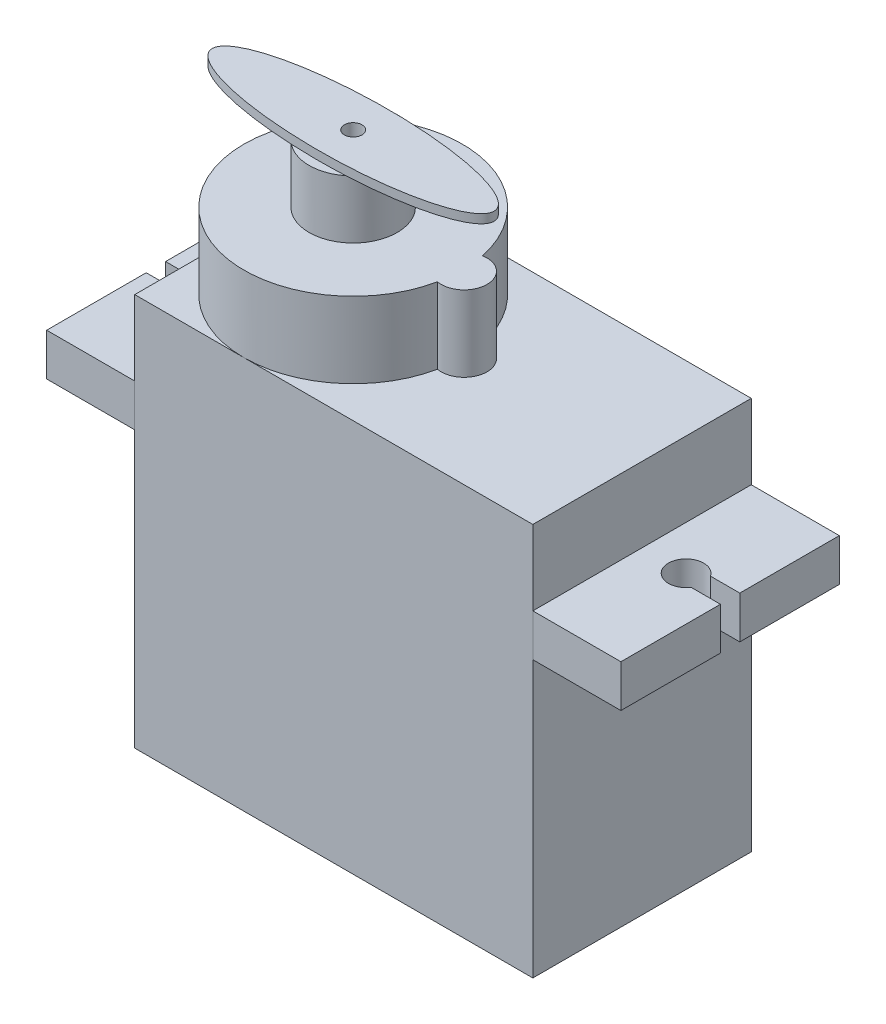
from build123d import *

# Parameters (mm, degrees)
SKETCH1_W             = 22.6
SKETCH1_H             = 12.4
BOSS_EXTRUDE1_DEPTH   = 22.3
SKETCH2_W             = 12.4
SKETCH2_H             = 2.4
BOSS_EXTRUDE2_DEPTH   = 5
SKETCH3_W             = 12.4
SKETCH3_H             = 2.4
BOSS_EXTRUDE3_DEPTH   = 5
CUT_EXTRUDE1_DEPTH    = 2.4
CUT_EXTRUDE2_DEPTH    = 2.4
BOSS_EXTRUDE4_DEPTH   = 4.3
SKETCH7_R             = 2.5
BOSS_EXTRUDE5_DEPTH   = 3.3
SKETCH8_R             = 0.6
BOSS_EXTRUDE7_DEPTH   = 2.3
BOSS_EXTRUDE7_2_DEPTH = 2.3
BOSS_EXTRUDE7_3_DEPTH = 2.3
SKETCH9_RX            = 7.998818951
SKETCH9_RY            = 2
BOSS_EXTRUDE10_DEPTH  = 0.5
SKETCH12_R            = 0.5
CUT_EXTRUDE4_DEPTH    = 1


with BuildPart() as part:
    # Sketch1 → Boss-Extrude1 (new body)
    with BuildSketch(Plane(origin=(0, 0, 0), x_dir=(1, 0, 0), z_dir=(0, 1, 0))):
        Rectangle(SKETCH1_W, SKETCH1_H)
    extrude(amount=BOSS_EXTRUDE1_DEPTH)

    # Sketch6 → Boss-Extrude4 (add)
    with BuildSketch(Plane(origin=(0, 22.3, 0), x_dir=(1, 0, 0), z_dir=(0, 1, 0))):
        with BuildLine():
            ThreePointArc((0.966666667, -1.278888406), (2.5, 0), (0.966666667, 1.278888406))
            ThreePointArc((0.966666667, 1.278888406), (-11.3, 0), (0.966666667, -1.278888406))
        make_face()
    extrude(amount=BOSS_EXTRUDE4_DEPTH)

    # Sketch7 → Boss-Extrude5 (add)
    with BuildSketch(Plane(origin=(0, 26.6, 0), x_dir=(1, 0, 0), z_dir=(0, 1, 0))):
        with Locations(Location((-5.1, 0, 0), (0, 0, 270))):
            Circle(SKETCH7_R)
    extrude(amount=BOSS_EXTRUDE5_DEPTH)

    # Sketch9 → Boss-Extrude10 (add)
    with BuildSketch(Plane(origin=(0, 29.9, 0), x_dir=(1, 0, 0), z_dir=(0, 1, 0))):
        with Locations((-5.1, 0)):
            Ellipse(SKETCH9_RX, SKETCH9_RY)
    extrude(amount=BOSS_EXTRUDE10_DEPTH)

    # Sketch12 → Cut-Extrude4 (cut)
    with BuildSketch(Plane(origin=(0, 30.4, 0), x_dir=(1, 0, 0), z_dir=(0, 1, 0))):
        with Locations(Location((-5.1, 0, 0), (0, 0, 270))):
            Circle(SKETCH12_R)
    extrude(amount=-CUT_EXTRUDE4_DEPTH, mode=Mode.SUBTRACT)


with BuildPart() as body_2:
    # Sketch2 → Boss-Extrude2 (new body)
    with BuildSketch(Plane(origin=(11.3, 0, 0), x_dir=(0, 0, -1), z_dir=(1, 0, 0))):
        with Locations((0, 16.85)):
            Rectangle(SKETCH2_W, SKETCH2_H)
    extrude(amount=BOSS_EXTRUDE2_DEPTH)

    # Sketch5 → Cut-Extrude2 (cut)
    with BuildSketch(Plane(origin=(0, 18.05, 0), x_dir=(1, 0, 0), z_dir=(0, 1, 0))):
        with BuildLine():
            Line((14.635164654, 0.55), (16.3, 0.55))
            Line((16.3, 0.55), (16.3, -0.55))
            Line((16.3, -0.55), (14.635164654, -0.55))
            ThreePointArc((14.635164654, -0.55), (12.8, 0), (14.635164654, 0.55))
        make_face()
    extrude(amount=-CUT_EXTRUDE2_DEPTH, mode=Mode.SUBTRACT)


with BuildPart() as body_3:
    # Sketch3 → Boss-Extrude3 (new body)
    with BuildSketch(Plane.ZY.offset(11.3)):
        with Locations((0, 16.85)):
            Rectangle(SKETCH3_W, SKETCH3_H)
    extrude(amount=BOSS_EXTRUDE3_DEPTH)

    # Sketch4 → Cut-Extrude1 (cut)
    with BuildSketch(Plane(origin=(0, 18.05, 0), x_dir=(1, 0, 0), z_dir=(0, 1, 0))):
        with BuildLine():
            Line((-16.3, 0.55), (-14.635164654, 0.55))
            ThreePointArc((-14.635164654, 0.55), (-12.8, 0), (-14.635164654, -0.55))
            Line((-14.635164654, -0.55), (-16.3, -0.55))
            Line((-16.3, -0.55), (-16.3, 0.55))
        make_face()
        with BuildLine():
            Line((16.3, -0.55), (14.635164654, -0.55))
            ThreePointArc((14.635164654, -0.55), (12.8, 0), (14.635164654, 0.55))
            Line((14.635164654, 0.55), (16.3, 0.55))
            Line((16.3, 0.55), (16.3, -0.55))
        make_face()
    extrude(amount=-CUT_EXTRUDE1_DEPTH, mode=Mode.SUBTRACT)


with BuildPart() as body_4:
    # Sketch8 → Boss-Extrude7 (new body)
    with BuildSketch(Plane.ZY.offset(11.3)):
        with Locations((0, 4.5)):
            Circle(SKETCH8_R)
    extrude(amount=BOSS_EXTRUDE7_DEPTH)


with BuildPart() as body_5:
    # Sketch8 → Boss-Extrude7 2 (new body)
    with BuildSketch(Plane.ZY.offset(11.3)):
        with Locations((-1.2, 4.5)):
            Circle(SKETCH8_R)
    extrude(amount=BOSS_EXTRUDE7_2_DEPTH)


with BuildPart() as body_6:
    # Sketch8 → Boss-Extrude7 3 (new body)
    with BuildSketch(Plane.ZY.offset(11.3)):
        with Locations((1.2, 4.5)):
            Circle(SKETCH8_R)
    extrude(amount=BOSS_EXTRUDE7_3_DEPTH)


solid = Compound([part.part, body_2.part, body_3.part, body_4.part, body_5.part, body_6.part])
